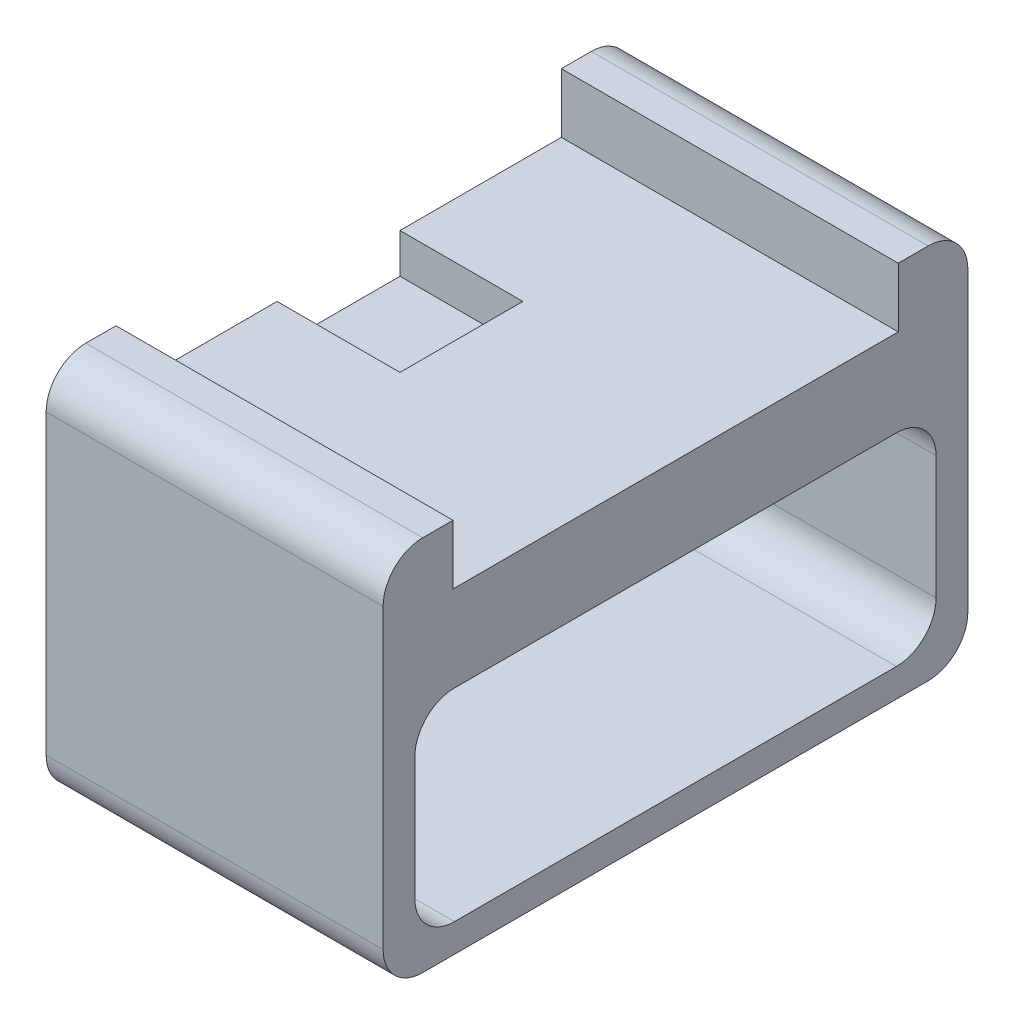
from build123d import *

# Parameters (mm, degrees)
BOSS_EXTRUDE1_DEPTH     = 21
SKETCH5_W               = 6.2
SKETCH5_H               = 6.2
CUT_EXTRUDE1_DEPTH      = 5
CUT_EXTRUDE2_DEPTH      = 28.364438602
CUT_EXTRUDE2_DEPTH_BACK = 28.364438602
SKETCH9_W               = 24.284850455
SKETCH9_H               = 22.464844075
CUT_EXTRUDE3_DEPTH      = 3
SKETCH10_W              = 31.815901763
SKETCH10_H              = 21.67332365
CUT_EXTRUDE4_DEPTH      = 4


with BuildPart() as part:
    # Sketch3 → Boss-Extrude1 (new body)
    with BuildSketch(Plane(origin=(0, 0, 0), x_dir=(0, 0, -1), z_dir=(1, 0, 0))):
        with BuildLine():
            Line((-12.75, -9.5), (12.75, -9.5))
            ThreePointArc((12.75, -9.5), (14.164213562, -8.914213562), (14.75, -7.5))
            Line((14.75, -7.5), (14.75, 7.5))
            ThreePointArc((14.75, 7.5), (14.164213562, 8.914213562), (12.75, 9.5))
            Line((12.75, 9.5), (-12.75, 9.5))
            ThreePointArc((-12.75, 9.5), (-14.164213562, 8.914213562), (-14.75, 7.5))
            Line((-14.75, 7.5), (-14.75, -7.5))
            ThreePointArc((-14.75, -7.5), (-14.164213562, -8.914213562), (-12.75, -9.5))
        make_face()
    extrude(amount=BOSS_EXTRUDE1_DEPTH)

    # Sketch5 → Cut-Extrude1 (cut)
    with BuildSketch(Plane(origin=(0, 9.5, 0), x_dir=(1, 0, 0), z_dir=(0, 1, 0))):
        with Locations((3.1, 0)):
            Rectangle(SKETCH5_W, SKETCH5_H)
    extrude(amount=-CUT_EXTRUDE1_DEPTH, mode=Mode.SUBTRACT)

    # Sketch7 → Cut-Extrude2 (cut, two sides: drawn at the far end of the back side and taken through both)
    with BuildSketch(Plane.ZY.offset(-CUT_EXTRUDE2_DEPTH_BACK)):
        with BuildLine():
            Line((-11.147623693, -8.072928754), (11.147623693, -8.072928754))
            ThreePointArc((11.147623693, -8.072928754), (12.561837255, -7.487142316), (13.147623693, -6.072928754))
            Line((13.147623693, -6.072928754), (13.147623693, 0.135263404))
            ThreePointArc((13.147623693, 0.135263404), (12.561837255, 1.549476966), (11.147623693, 2.135263404))
            Line((11.147623693, 2.135263404), (-11.147623693, 2.135263404))
            ThreePointArc((-11.147623693, 2.135263404), (-12.561837255, 1.549476966), (-13.147623693, 0.135263404))
            Line((-13.147623693, 0.135263404), (-13.147623693, -6.072928754))
            ThreePointArc((-13.147623693, -6.072928754), (-12.561837255, -7.487142316), (-11.147623693, -8.072928754))
        make_face()
    extrude(amount=CUT_EXTRUDE2_DEPTH + CUT_EXTRUDE2_DEPTH_BACK, mode=Mode.SUBTRACT)

    # Sketch9 → Cut-Extrude3 (cut)
    with BuildSketch(Plane(origin=(0, 9.5, 0), x_dir=(1, 0, 0), z_dir=(0, 1, 0))):
        with Locations((12.142425228, 0.007615305)):
            Rectangle(SKETCH9_W, SKETCH9_H)
    extrude(amount=-CUT_EXTRUDE3_DEPTH, mode=Mode.SUBTRACT)

    # Sketch10 → Cut-Extrude4 (cut)
    with BuildSketch(Plane(origin=(21, 0, 0), x_dir=(0, 0, -1), z_dir=(1, 0, 0))):
        with Locations((-0.011194899, 0.447795943)):
            Rectangle(SKETCH10_W, SKETCH10_H)
    extrude(amount=-CUT_EXTRUDE4_DEPTH, mode=Mode.SUBTRACT)


solid = part.part
